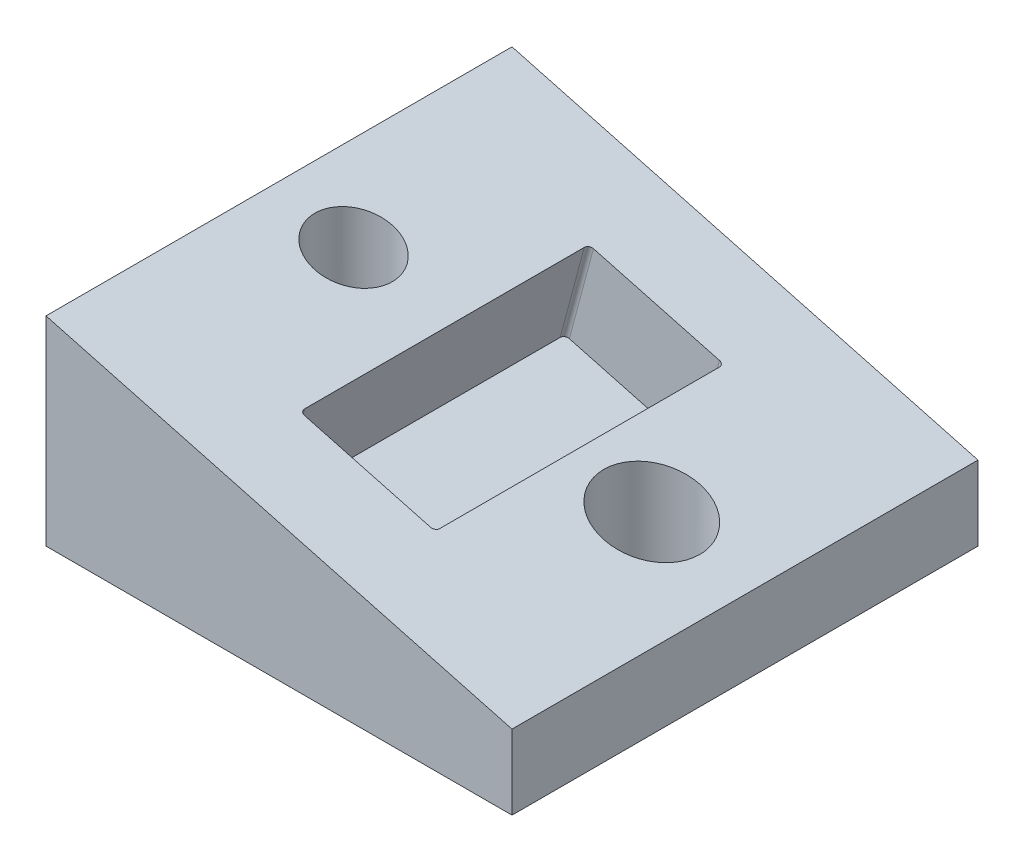
from build123d import *

# Parameters (mm, degrees)
EXTRUDE_8_DEPTH     = 50
SKETCH_9_R          = 5.15
SKETCH_9_R_2        = 4.15
CUT_EXTRUDE_2_DEPTH = 50
SKETCH_10_W         = 15
SKETCH_10_H         = 31
CUT_EXTRUDE_3_DEPTH = 10
FILLET_1_R          = 0.5


with BuildPart() as part:
    # 草图8 → 凸台-拉伸8 (new body)
    with BuildSketch(Plane.XY):
        Polygon((25, -4), (25, 4), (-25, 17.397459622), (-25, 4), (-25, -4), align=None)
    extrude(amount=EXTRUDE_8_DEPTH)

    # 草图9 → 切除-拉伸2 (cut)
    with BuildSketch(Plane.XZ.offset(4)):
        with Locations(Location((15, 25, 0), (0, 0, 270))):
            Circle(SKETCH_9_R)
        with Locations(Location((-17, 25, 0), (0, 0, 270))):
            Circle(SKETCH_9_R_2)
    extrude(amount=-CUT_EXTRUDE_2_DEPTH, mode=Mode.SUBTRACT)

    # 草图10 → 切除-拉伸3 (cut)
    with BuildSketch(Plane(origin=(2.674682453, 9.982050808, 0), x_dir=(0.9659258262890701, -0.2588190451025142, 0), z_dir=(0.2588190451025142, 0.9659258262890701, 0))):
        with Locations((-2.767130523, -25)):
            Rectangle(SKETCH_10_W, SKETCH_10_H)
    extrude(amount=-CUT_EXTRUDE_3_DEPTH, mode=Mode.SUBTRACT)

    # 圆角1
    fillet_1_edges = [part.edges().sort_by_distance(p)[0] for p in [
        (-8.536699307, 7.809750594, 9.5),
        (5.952188087, 3.927464918, 9.5),
        (5.952188087, 3.927464918, 40.5),
        (-8.536699307, 7.809750594, 40.5),
    ]]
    fillet(fillet_1_edges, radius=FILLET_1_R)


solid = part.part
